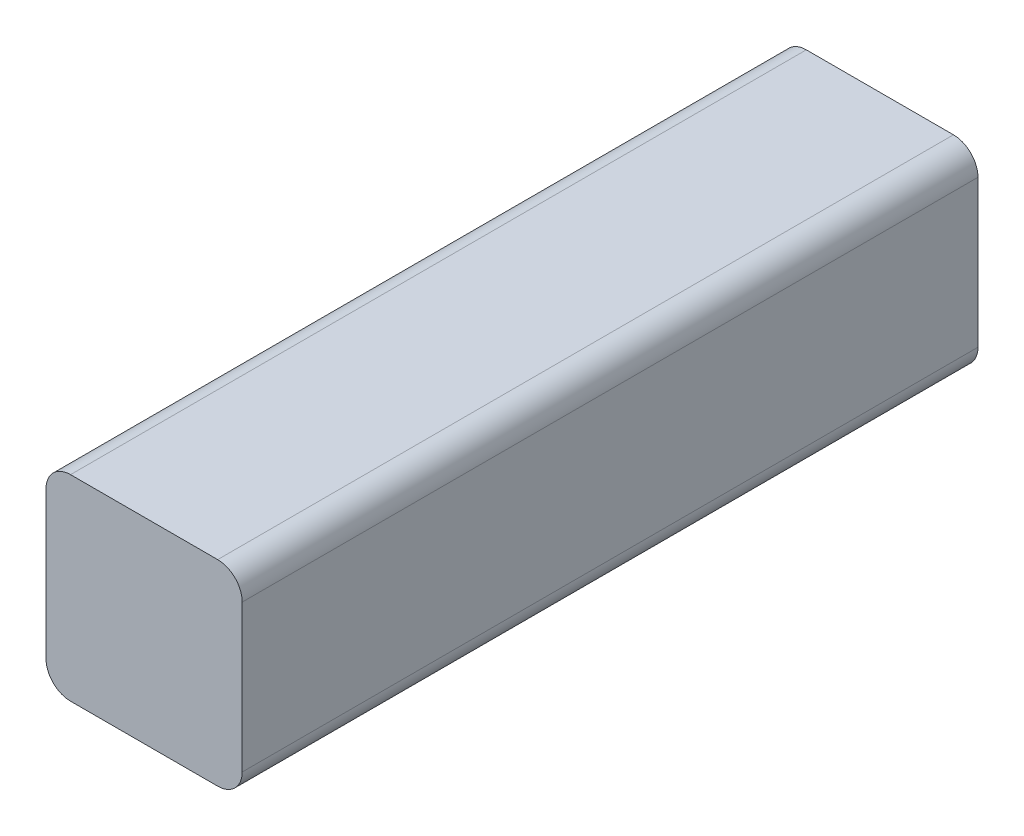
from build123d import *

# Parameters (mm, degrees)
SKETCH1_W           = 40
SKETCH1_H           = 40
BOSS_EXTRUDE1_DEPTH = 150
FILLET1_R           = 5


with BuildPart() as part:
    # Sketch1 → Boss-Extrude1 (new body)
    with BuildSketch(Plane.XY):
        with Locations((0, -43)):
            Rectangle(SKETCH1_W, SKETCH1_H)
    extrude(amount=BOSS_EXTRUDE1_DEPTH)

    # Fillet1
    fillet1_edges = [part.edges().sort_by_distance(p)[0] for p in [
        (20, -63, 75),
        (-20, -63, 75),
        (-20, -23, 75),
        (20, -23, 75),
    ]]
    fillet(fillet1_edges, radius=FILLET1_R)


solid = part.part
